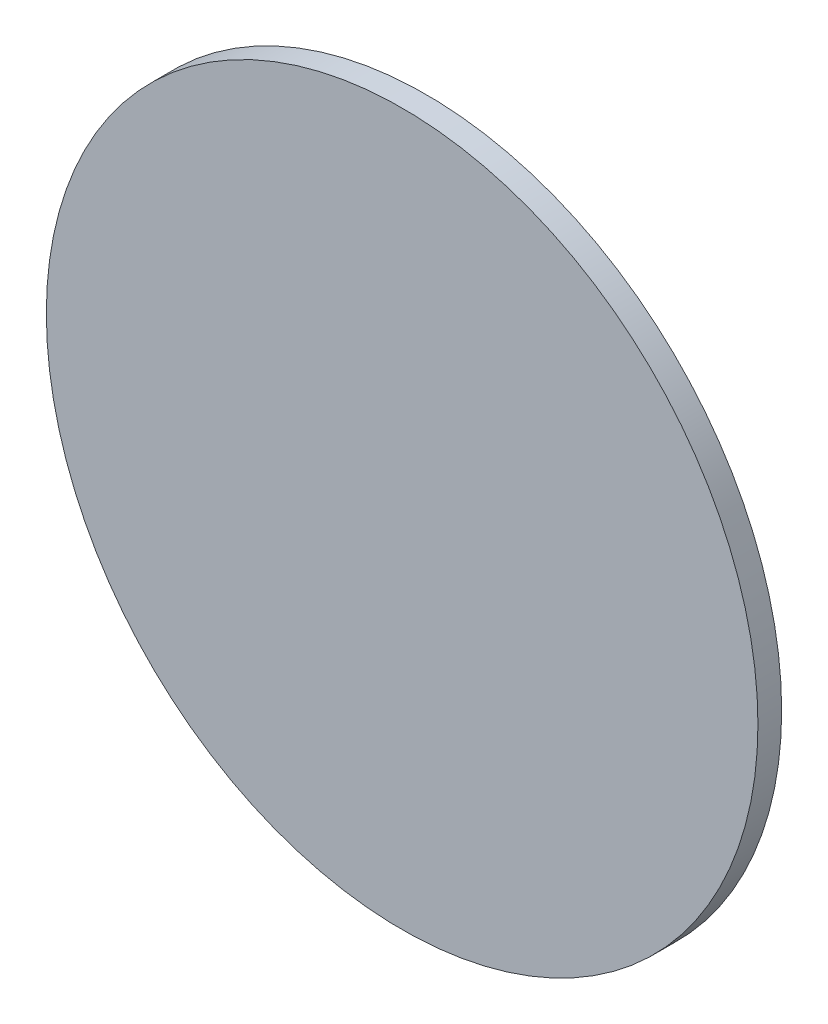
from build123d import *

# Parameters (mm, degrees)
SKETCH1_R           = 150
BOSS_EXTRUDE1_DEPTH = 10


with BuildPart() as part:
    # Sketch1 → Boss-Extrude1 (new body)
    with BuildSketch(Plane.XY):
        Circle(SKETCH1_R)
    extrude(amount=BOSS_EXTRUDE1_DEPTH)


solid = part.part
